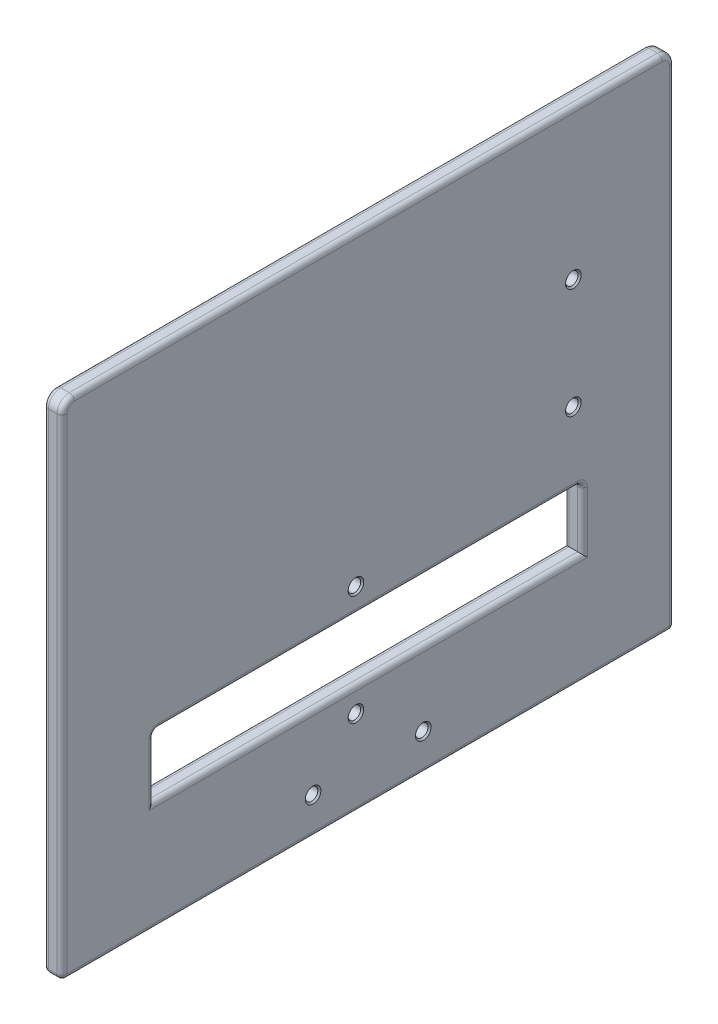
from build123d import *

# Parameters (mm, degrees)
SKETCH_1_W                     = 50
SKETCH_1_H                     = 100
EXTRUDE_1_DEPTH                = 2
SKETCH_2_W                     = 3
SKETCH_2_H                     = 100
EXTRUDE_2_DEPTH                = 80
SKETCH_3_W                     = 2
SKETCH_3_H                     = 66.7
EXTRUDE_3_DEPTH                = 70
CUT_EXTRUDE_4_REACH            = 162.465
SKETCH_8_W                     = 2
SKETCH_8_H                     = 66.7
EXTRUDE_4_DEPTH                = 70
CUT_EXTRUDE_5_REACH            = 140.25
HOLE_WIZARD_M3_1_D             = 2.5
HOLE_WIZARD_M3_1_DEPTH         = 2
HOLE_WIZARD_M3_1_CSINK_D       = 3.05
HOLE_WIZARD_M3_1_CSINK_ANGLE   = 90
FILLET_1_R                     = 2
CUT_EXTRUDE_6_REACH            = 140.25
SKETCH_12_R                    = 11
CUT_EXTRUDE_7_REACH            = 162.465
SKETCH_13_R                    = 14.5
SKETCH_14_W                    = 2
SKETCH_14_H                    = 66.7
EXTRUDE_5_DEPTH                = 70
CUT_EXTRUDE_8_REACH            = 156.14
SKETCH_15_R                    = 5.1
CUT_EXTRUDE_9_DEPTH            = 155.140358116
CUT_EXTRUDE_9_DEPTH_BACK       = 155.140358116
SKETCH_19_W                    = 2
SKETCH_19_H                    = 66.7
CUT_EXTRUDE_10_DEPTH           = 119.844436134
FILLET_2_R                     = 2
CUT_EXTRUDE_12_DEPTH           = 134.88427839
CUT_EXTRUDE_12_DEPTH_BACK      = 134.88427839
SKETCH_20_W                    = 47
SKETCH_20_H                    = 100
SKETCH_20_W_2                  = 70
SKETCH_20_H_2                  = 2
HOLE_WIZARD_M2_5_1_D           = 2.05
HOLE_WIZARD_M2_5_1_CSINK_D     = 2.55
HOLE_WIZARD_M2_5_1_CSINK_ANGLE = 90
SKETCH_23_W                    = 70
SKETCH_23_H                    = 10
CUT_EXTRUDE_13_DEPTH           = 97.088500873
FILLET_3_R                     = 0.8
FILLET_4_R                     = 0.8


with BuildPart() as part:
    # 草图1 → 凸台-拉伸1 (new body)
    with BuildSketch(Plane(origin=(0, 0, 0), x_dir=(1, 0, 0), z_dir=(0, 1, 0))):
        Rectangle(SKETCH_1_W, SKETCH_1_H)
    extrude(amount=EXTRUDE_1_DEPTH)

    # 草图2 → 凸台-拉伸2 (add)
    with BuildSketch(Plane(origin=(0, 2, 0), x_dir=(1, 0, 0), z_dir=(0, 1, 0))):
        with Locations((-23.5, 0)):
            Rectangle(SKETCH_2_W, SKETCH_2_H)
    extrude(amount=EXTRUDE_2_DEPTH)

    # 草图3 → 凸台-拉伸3 (add)
    with BuildSketch(Plane.ZY.offset(25)):
        with Locations((-49, 48.65)):
            Rectangle(SKETCH_3_W, SKETCH_3_H)
    extrude(amount=EXTRUDE_3_DEPTH)

    # 草图4 → 切除-拉伸4 (cut, up to next)
    with BuildSketch(Plane(origin=(0, 0, -50), x_dir=(-1, 0, 0), z_dir=(0, 0, -1)), mode=Mode.PRIVATE) as cut_extrude_4_sk1:
        with BuildLine():
            Line((95, 82), (61.65, 82))
            ThreePointArc((61.65, 82), (85.232011153, 72.232011153), (95, 48.65))
            Line((95, 48.65), (95, 82))
        make_face()
    cut_extrude_4_tool1 = extrude(cut_extrude_4_sk1.sketch, amount=-CUT_EXTRUDE_4_REACH, mode=Mode.PRIVATE) & part.part
    # 草图4 → 切除-拉伸4 (cut, up to next)
    with BuildSketch(Plane(origin=(0, 0, -50), x_dir=(-1, 0, 0), z_dir=(0, 0, -1)), mode=Mode.PRIVATE) as cut_extrude_4_sk2:
        with BuildLine():
            ThreePointArc((95, 48.65), (85.232011153, 25.067988847), (61.65, 15.3))
            Line((61.65, 15.3), (95, 15.3))
            Line((95, 15.3), (95, 48.65))
        make_face()
    cut_extrude_4_tool2 = extrude(cut_extrude_4_sk2.sketch, amount=-CUT_EXTRUDE_4_REACH, mode=Mode.PRIVATE) & part.part
    add(cut_extrude_4_tool1.solids().sort_by_distance((-87.550679, 74.550679, -50))[0], mode=Mode.SUBTRACT)
    add(cut_extrude_4_tool2.solids().sort_by_distance((-87.550679, 22.749321, -50))[0], mode=Mode.SUBTRACT)

    # 草图8 → 凸台-拉伸4 (add)
    with BuildSketch(Plane.ZY.offset(25)):
        with Locations((7, 48.65)):
            Rectangle(SKETCH_8_W, SKETCH_8_H)
    extrude(amount=EXTRUDE_4_DEPTH)

    # 草图9 → 切除-拉伸5 (cut, up to next)
    with BuildSketch(Plane.XY.offset(8), mode=Mode.PRIVATE) as cut_extrude_5_sk1:
        with BuildLine():
            ThreePointArc((-95, 48.65), (-85.232011153, 72.232011153), (-61.65, 82))
            Line((-61.65, 82), (-95, 82))
            Line((-95, 82), (-95, 48.65))
        make_face()
    cut_extrude_5_tool1 = extrude(cut_extrude_5_sk1.sketch, amount=-CUT_EXTRUDE_5_REACH, mode=Mode.PRIVATE) & part.part
    # 草图9 → 切除-拉伸5 (cut, up to next)
    with BuildSketch(Plane.XY.offset(8), mode=Mode.PRIVATE) as cut_extrude_5_sk2:
        with BuildLine():
            ThreePointArc((-61.65, 15.3), (-85.232011153, 25.067988847), (-95, 48.65))
            Line((-95, 48.65), (-95, 15.3))
            Line((-95, 15.3), (-61.65, 15.3))
        make_face()
    cut_extrude_5_tool2 = extrude(cut_extrude_5_sk2.sketch, amount=-CUT_EXTRUDE_5_REACH, mode=Mode.PRIVATE) & part.part
    add(cut_extrude_5_tool1.solids().sort_by_distance((-87.550679, 74.550679, 8))[0], mode=Mode.SUBTRACT)
    add(cut_extrude_5_tool2.solids().sort_by_distance((-87.550679, 22.749321, 8))[0], mode=Mode.SUBTRACT)

    # M3 螺纹孔1
    with Locations(Plane.XY.offset(8)):
        with Locations((-78.970508076, 38.65), (-61.65, 68.65), (-44.329491924, 38.65)):
            CounterSinkHole(HOLE_WIZARD_M3_1_D / 2, HOLE_WIZARD_M3_1_CSINK_D / 2, depth=HOLE_WIZARD_M3_1_DEPTH, counter_sink_angle=HOLE_WIZARD_M3_1_CSINK_ANGLE)

    # 圆角1
    fillet_1_edges = [part.edges().sort_by_distance(p)[0] for p in [
        (-23.5, 82, 50),
        (25, 1, 50),
        (25, 1, -50),
    ]]
    fillet(fillet_1_edges, radius=FILLET_1_R)

    # 草图12 → 切除-拉伸6 (cut, up to next)
    with BuildSketch(Plane.XY.offset(8), mode=Mode.PRIVATE) as cut_extrude_6_sk1:
        with Locations((-61.65, 48.65)):
            Circle(SKETCH_12_R)
    cut_extrude_6_tool1 = extrude(cut_extrude_6_sk1.sketch, amount=-CUT_EXTRUDE_6_REACH, mode=Mode.PRIVATE) & part.part
    add(cut_extrude_6_tool1.solids().sort_by_distance((-61.65, 48.65, 8))[0], mode=Mode.SUBTRACT)

    # 草图13 → 切除-拉伸7 (cut, up to next)
    with BuildSketch(Plane(origin=(0, 0, -50), x_dir=(-1, 0, 0), z_dir=(0, 0, -1)), mode=Mode.PRIVATE) as cut_extrude_7_sk1:
        with Locations((61.65, 48.65)):
            Circle(SKETCH_13_R)
    cut_extrude_7_tool1 = extrude(cut_extrude_7_sk1.sketch, amount=-CUT_EXTRUDE_7_REACH, mode=Mode.PRIVATE) & part.part
    add(cut_extrude_7_tool1.solids().sort_by_distance((-61.65, 48.65, -50))[0], mode=Mode.SUBTRACT)

    # 草图14 → 凸台-拉伸5 (add)
    with BuildSketch(Plane.ZY.offset(25)):
        with Locations((-38.5, 48.65)):
            Rectangle(SKETCH_14_W, SKETCH_14_H)
    extrude(amount=EXTRUDE_5_DEPTH)

    # 草图15 → 切除-拉伸8 (cut, up to next)
    with BuildSketch(Plane(origin=(0, 0, -39.5), x_dir=(-1, 0, 0), z_dir=(0, 0, -1)), mode=Mode.PRIVATE) as cut_extrude_8_sk1:
        with Locations(Location((61.65, 48.65, 0), (0, 0, 90))):
            Circle(SKETCH_15_R)
    cut_extrude_8_tool1 = extrude(cut_extrude_8_sk1.sketch, amount=-CUT_EXTRUDE_8_REACH, mode=Mode.PRIVATE) & part.part
    add(cut_extrude_8_tool1.solids().sort_by_distance((-61.65, 48.65, -39.5))[0], mode=Mode.SUBTRACT)

    # 草图18 → 切除-拉伸9 (cut, two sides: drawn at the far end of the back side and taken through both)
    with BuildSketch(Plane(origin=(0, 0, -39.5), x_dir=(-1, 0, 0), z_dir=(0, 0, -1)).offset(-CUT_EXTRUDE_9_DEPTH_BACK)):
        with BuildLine():
            Line((95, 15.3), (95, 48.65))
            ThreePointArc((95, 48.65), (85.232011153, 25.067988847), (61.65, 15.3))
            Line((61.65, 15.3), (95, 15.3))
        make_face()
        with BuildLine():
            Line((95, 48.65), (95, 82))
            Line((95, 82), (61.65, 82))
            ThreePointArc((61.65, 82), (85.232011153, 72.232011153), (95, 48.65))
        make_face()
    extrude(amount=CUT_EXTRUDE_9_DEPTH + CUT_EXTRUDE_9_DEPTH_BACK, mode=Mode.SUBTRACT)

    # 草图19 → 切除-拉伸10 (cut, through all)
    with BuildSketch(Plane.ZY.offset(25)):
        with Locations((-49, 48.65)):
            Rectangle(SKETCH_19_W, SKETCH_19_H)
    extrude(amount=CUT_EXTRUDE_10_DEPTH, mode=Mode.SUBTRACT)

    # 圆角2
    fillet_2_edges = [part.edges().sort_by_distance(p)[0] for p in [
        (-23.5, 82, -50),
    ]]
    fillet(fillet_2_edges, radius=FILLET_2_R)

    # 草图20 → 切除-拉伸12 (cut, two sides: drawn at the far end of the back side and taken through both)
    with BuildSketch(Plane(origin=(0, 2, 0), x_dir=(1, 0, 0), z_dir=(0, 1, 0)).offset(-CUT_EXTRUDE_12_DEPTH_BACK)):
        with Locations((1.5, 0)):
            Rectangle(SKETCH_20_W, SKETCH_20_H)
        with Locations((-60, 38.5)):
            Rectangle(SKETCH_20_W_2, SKETCH_20_H_2)
        with Locations((-60, -7)):
            Rectangle(SKETCH_20_W_2, SKETCH_20_H_2)
    extrude(amount=CUT_EXTRUDE_12_DEPTH + CUT_EXTRUDE_12_DEPTH_BACK, mode=Mode.SUBTRACT)

    # M2.5 螺纹孔1 (through all)
    with Locations(Plane(origin=(-22, 0, 0), x_dir=(0, 0, -1), z_dir=(1, 0, 0))):
        with Locations((-2, 14), (-9, 6), (9, 6), (33.5, 57.65), (33.5, 39.65), (-2, 32)):
            CounterSinkHole(HOLE_WIZARD_M2_5_1_D / 2, HOLE_WIZARD_M2_5_1_CSINK_D / 2, counter_sink_angle=HOLE_WIZARD_M2_5_1_CSINK_ANGLE)

    # 草图23 → 切除-拉伸13 (cut, through all)
    with BuildSketch(Plane(origin=(-22, 0, 0), x_dir=(0, 0, -1), z_dir=(1, 0, 0))):
        with Locations((0, 23)):
            Rectangle(SKETCH_23_W, SKETCH_23_H)
    extrude(amount=-CUT_EXTRUDE_13_DEPTH, mode=Mode.SUBTRACT)

    # 圆角3
    fillet_3_edges = [part.edges().sort_by_distance(p)[0] for p in [
        (-22, 82, 0),
        (-22, 40, 50),
        (-22, 81.414213562, 49.414213562),
        (-25, 40, 50),
        (-25, 81.414213562, 49.414213562),
        (-25, 40, -50),
        (-25, 81.414213562, -49.414213562),
        (-22, 40, -50),
        (-22, 81.414213562, -49.414213562),
        (-25, 23, 35),
        (-25, 28, 0),
        (-23.5, 28, 35),
        (-25, 23, -35),
        (-23.5, 28, -35),
        (-25, 18, 0),
        (-22, 23, 35),
        (-22, 18, 0),
        (-22, 23, -35),
        (-22, 28, 0),
        (-25, 82, 0),
    ]]
    fillet(fillet_3_edges, radius=FILLET_3_R)

    # 圆角4
    fillet_4_edges = [part.edges().sort_by_distance(p)[0] for p in [
        (-25, 0, 0),
        (-22, 0, 0),
        (-23.5, 0, 50),
        (-23.5, 0, -50),
        (-22.234314575, 0, -49.765685425),
        (-24.765685425, 0, -49.765685425),
        (-22.234314575, 0, 49.765685425),
        (-24.765685425, 0, 49.765685425),
    ]]
    fillet(fillet_4_edges, radius=FILLET_4_R)


solid = part.part
